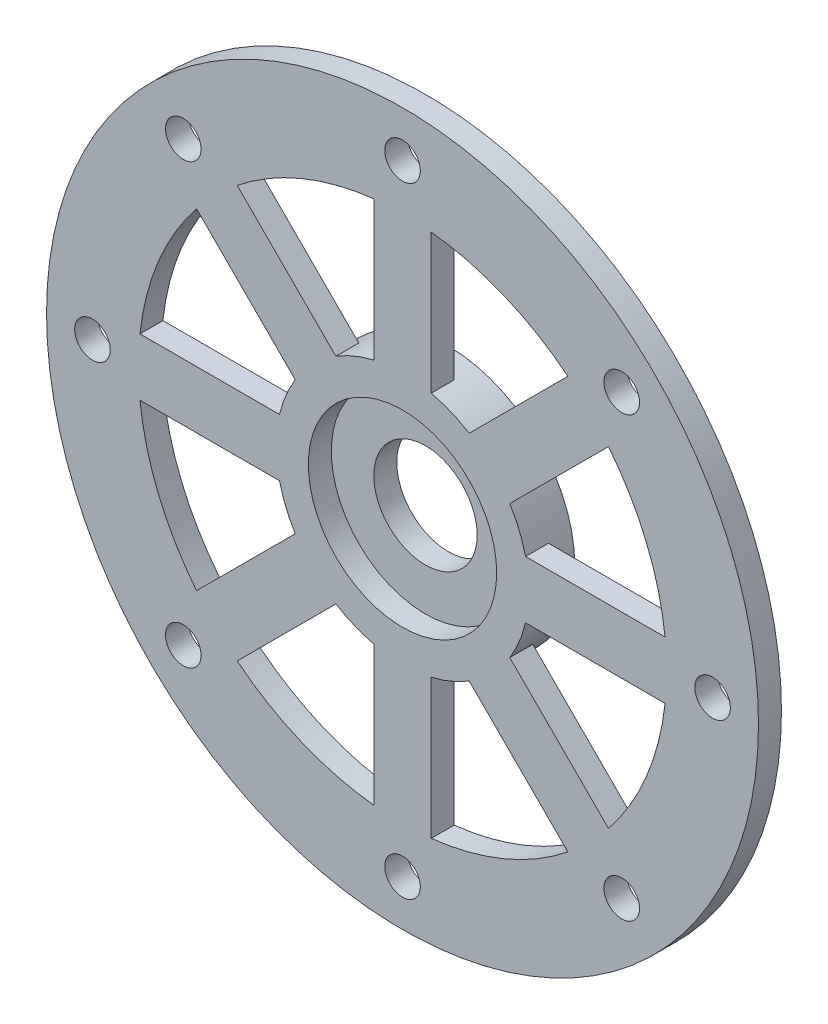
from build123d import *
from build123d.topology import SkipClean

# Parameters (mm, degrees)
SKETCH1_R           = 31
SKETCH1_R_2         = 1.55
BOSS_EXTRUDE1_DEPTH = 2
BOSS_EXTRUDE2_START = 2
SKETCH3_R           = 11
BOSS_EXTRUDE2_DEPTH = 2
SKETCH4_R           = 4.5
CUT_EXTRUDE2_DEPTH  = 4
SKETCH2_R           = 8.2
CUT_EXTRUDE1_DEPTH  = 2


with BuildPart() as part:
    # Sketch1 → Boss-Extrude1 (new body)
    with BuildSketch(Plane.XY):
        Circle(SKETCH1_R)
        with Locations((-27, 0)):
            Circle(SKETCH1_R_2, mode=Mode.SUBTRACT)
        with Locations((-19.091883092, 19.091883092)):
            Circle(SKETCH1_R_2, mode=Mode.SUBTRACT)
        with Locations((0, 27)):
            Circle(SKETCH1_R_2, mode=Mode.SUBTRACT)
        with Locations((19.091883092, 19.091883092)):
            Circle(SKETCH1_R_2, mode=Mode.SUBTRACT)
        with Locations((27, 0)):
            Circle(SKETCH1_R_2, mode=Mode.SUBTRACT)
        with Locations((19.091883092, -19.091883092)):
            Circle(SKETCH1_R_2, mode=Mode.SUBTRACT)
        with Locations((0, -27)):
            Circle(SKETCH1_R_2, mode=Mode.SUBTRACT)
        with Locations((-19.091883092, -19.091883092)):
            Circle(SKETCH1_R_2, mode=Mode.SUBTRACT)
        with BuildLine():
            Line((-10.712142643, 2.5), (-22.86372673, 2.5))
            ThreePointArc((-22.86372673, 2.5), (-21.249229248, 8.801718944), (-17.934863167, 14.399329261))
            Line((-17.934863167, 14.399329261), (-9.342395657, 5.806861751))
            ThreePointArc((-9.342395657, 5.806861751), (-10.162674858, 4.209517756), (-10.712142643, 2.5))
        make_face(mode=Mode.SUBTRACT)
        with BuildLine():
            Line((-10.712142643, -2.5), (-22.86372673, -2.5))
            ThreePointArc((-22.86372673, -2.5), (-21.249229248, -8.801718944), (-17.934863167, -14.399329261))
            Line((-17.934863167, -14.399329261), (-9.342395657, -5.806861751))
            ThreePointArc((-9.342395657, -5.806861751), (-10.162674858, -4.209517756), (-10.712142643, -2.5))
        make_face(mode=Mode.SUBTRACT)
        with BuildLine():
            Line((-5.806861751, 9.342395657), (-14.399329261, 17.934863167))
            ThreePointArc((-14.399329261, 17.934863167), (-8.801718944, 21.249229248), (-2.5, 22.86372673))
            Line((-2.5, 22.86372673), (-2.5, 10.712142643))
            ThreePointArc((-2.5, 10.712142643), (-4.209517756, 10.162674858), (-5.806861751, 9.342395657))
        make_face(mode=Mode.SUBTRACT)
        with BuildLine():
            Line((2.5, 10.712142643), (2.5, 22.86372673))
            ThreePointArc((2.5, 22.86372673), (8.801718944, 21.249229248), (14.399329261, 17.934863167))
            Line((14.399329261, 17.934863167), (5.806861751, 9.342395657))
            ThreePointArc((5.806861751, 9.342395657), (4.209517756, 10.162674858), (2.5, 10.712142643))
        make_face(mode=Mode.SUBTRACT)
        with BuildLine():
            Line((9.342395657, 5.806861751), (17.934863167, 14.399329261))
            ThreePointArc((17.934863167, 14.399329261), (21.249229248, 8.801718944), (22.86372673, 2.5))
            Line((22.86372673, 2.5), (10.712142643, 2.5))
            ThreePointArc((10.712142643, 2.5), (10.162674858, 4.209517756), (9.342395657, 5.806861751))
        make_face(mode=Mode.SUBTRACT)
        with BuildLine():
            Line((10.712142643, -2.5), (22.86372673, -2.5))
            ThreePointArc((22.86372673, -2.5), (21.249229248, -8.801718944), (17.934863167, -14.399329261))
            Line((17.934863167, -14.399329261), (9.342395657, -5.806861751))
            ThreePointArc((9.342395657, -5.806861751), (10.162674858, -4.209517756), (10.712142643, -2.5))
        make_face(mode=Mode.SUBTRACT)
        with BuildLine():
            Line((5.806861751, -9.342395657), (14.399329261, -17.934863167))
            ThreePointArc((14.399329261, -17.934863167), (8.801718944, -21.249229248), (2.5, -22.86372673))
            Line((2.5, -22.86372673), (2.5, -10.712142643))
            ThreePointArc((2.5, -10.712142643), (4.209517756, -10.162674858), (5.806861751, -9.342395657))
        make_face(mode=Mode.SUBTRACT)
        with BuildLine():
            Line((-2.5, -10.712142643), (-2.5, -22.86372673))
            ThreePointArc((-2.5, -22.86372673), (-8.801718944, -21.249229248), (-14.399329261, -17.934863167))
            Line((-14.399329261, -17.934863167), (-5.806861751, -9.342395657))
            ThreePointArc((-5.806861751, -9.342395657), (-4.209517756, -10.162674858), (-2.5, -10.712142643))
        make_face(mode=Mode.SUBTRACT)
    extrude(amount=BOSS_EXTRUDE1_DEPTH)

    # Sketch3 → Boss-Extrude2 (add)
    with SkipClean():  # the faces are left unmerged after this step: merging them gives an invalid solid
        with BuildSketch(Plane(origin=(0, 0, 0), x_dir=(-1, 0, 0), z_dir=(0, 0, -1)).offset(BOSS_EXTRUDE2_START)):
            Circle(SKETCH3_R)
        extrude(amount=-BOSS_EXTRUDE2_DEPTH)

    # Sketch4 → Cut-Extrude2 (cut)
    with SkipClean():  # the faces are left unmerged after this step: merging them gives an invalid solid
        with BuildSketch(Plane.XY.offset(2)):
            Circle(SKETCH4_R)
        extrude(amount=-CUT_EXTRUDE2_DEPTH, mode=Mode.SUBTRACT)

    # Sketch2 → Cut-Extrude1 (cut)
    with SkipClean():  # the faces are left unmerged after this step: merging them gives an invalid solid
        with BuildSketch(Plane.XY.offset(2)):
            Circle(SKETCH2_R)
        extrude(amount=-CUT_EXTRUDE1_DEPTH, mode=Mode.SUBTRACT)


solid = part.part
